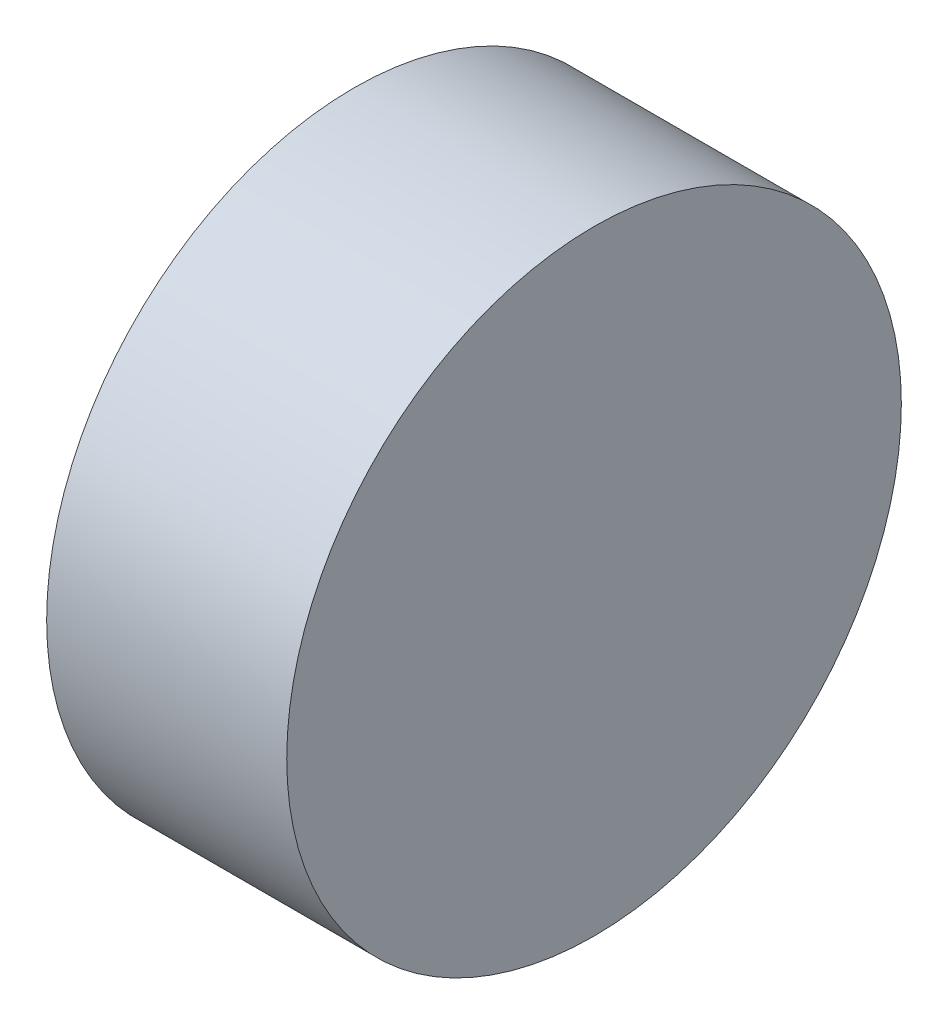
from build123d import *

# Parameters (mm, degrees)
BOSS_EXTRUDE1_DEPTH      = 12.5
BOSS_EXTRUDE1_DEPTH_BACK = 12.5
SKETCH1_R                = 32


with BuildPart() as part:
    # Sketch1 → Boss-Extrude1 (new, two sides: drawn at the far end of the back side and taken through both)
    with BuildSketch(Plane(origin=(0, 0, 0), x_dir=(0, 0, -1), z_dir=(1, 0, 0)).offset(-BOSS_EXTRUDE1_DEPTH_BACK)):
        Circle(SKETCH1_R)
    extrude(amount=BOSS_EXTRUDE1_DEPTH + BOSS_EXTRUDE1_DEPTH_BACK)


solid = part.part
